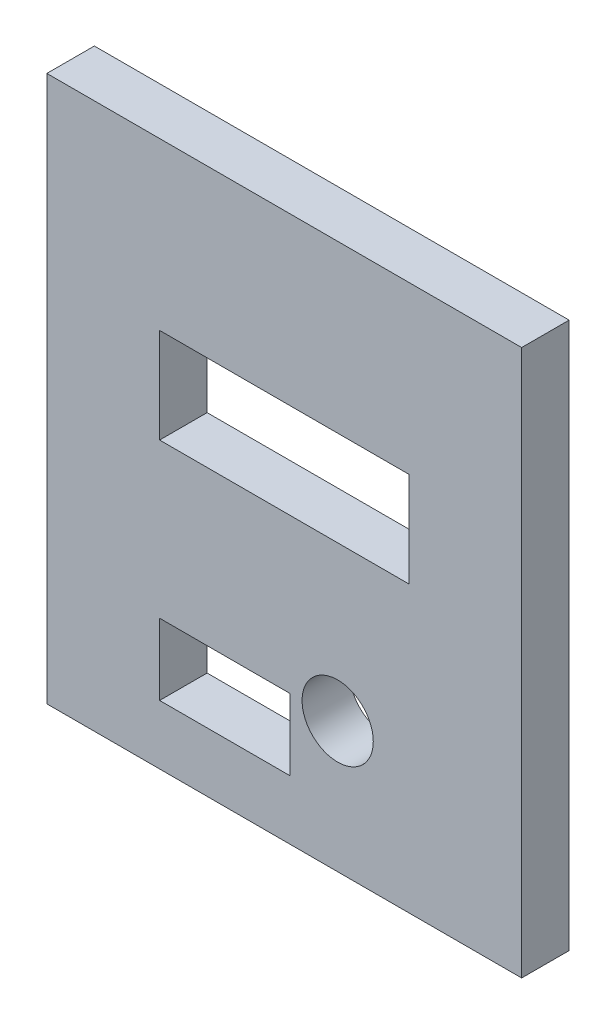
from build123d import *

# Parameters (mm, degrees)
SKETCH1_W           = 20
SKETCH1_H           = 23
BOSS_EXTRUDE1_DEPTH = 2
SKETCH2_W           = 10.5
SKETCH2_H           = 4
SKETCH2_W_2         = 5.5
SKETCH2_H_2         = 3
SKETCH2_R           = 1.5
CUT_EXTRUDE1_DEPTH  = 10


with BuildPart() as part:
    # Sketch1 → Boss-Extrude1 (new body)
    with BuildSketch(Plane.XY):
        Rectangle(SKETCH1_W, SKETCH1_H)
    extrude(amount=BOSS_EXTRUDE1_DEPTH)

    # Sketch2 → Cut-Extrude1 (cut)
    with BuildSketch(Plane.XY.offset(2)):
        with Locations((0, 2.5)):
            Rectangle(SKETCH2_W, SKETCH2_H)
        with Locations((-2.5, -7.5)):
            Rectangle(SKETCH2_W_2, SKETCH2_H_2)
        with Locations((2.25, -6)):
            Circle(SKETCH2_R)
    extrude(amount=-CUT_EXTRUDE1_DEPTH, mode=Mode.SUBTRACT)


solid = part.part
